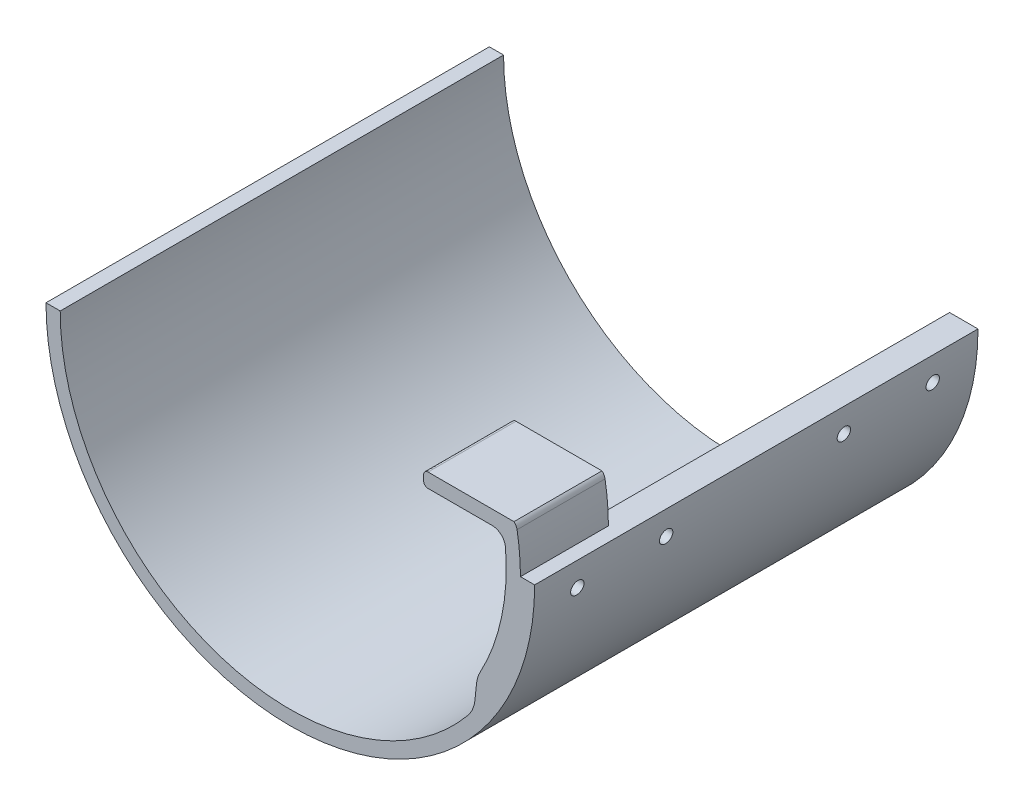
from build123d import *

# Parameters (mm, degrees)
EXTRUDE_1_DEPTH     = 99.8
SKETCH_7_R          = 1.5
CUT_EXTRUDE_6_DEPTH = 80
CUT_EXTRUDE_7_DEPTH = 80


with BuildPart() as part:
    # 草图1 → 凸台-拉伸1 (new body)
    with BuildSketch(Plane.XY):
        with BuildLine():
            Line((-55, 0), (-51.8, 0))
            ThreePointArc((-51.8, 0), (-17.476086779, -48.76296126), (40.00796876, -32.902924425))
            ThreePointArc((40.00796876, -32.902924425), (41.062164054, -31.150956215), (41.565129022, -29.16910189))
            Line((41.565129022, -29.16910189), (41.910264928, -25.795992674))
            ThreePointArc((41.910264928, -25.795992674), (42.185460224, -24.44340265), (42.720717667, -23.171108779))
            ThreePointArc((42.720717667, -23.171108779), (47.564735827, -9.977770578), (48.43095601, 4.05))
            ThreePointArc((48.43095601, 4.05), (47.472400425, 6.007940217), (45.441390824, 6.8))
            Line((45.441390824, 6.8), (31, 6.8))
            ThreePointArc((31, 6.8), (30.292893219, 7.092893219), (30, 7.8))
            Line((30, 7.8), (30, 9))
            ThreePointArc((30, 9), (30.292893219, 9.707106781), (31, 10))
            Line((31, 10), (50.344019583, 10))
            ThreePointArc((50.344019583, 10), (50.805346897, 9.459374484), (51.0484918, 8.791557597))
            ThreePointArc((51.0484918, 8.791557597), (51.611780996, 4.411809423), (51.8, 0))
            Line((51.8, 0), (55, 0))
            ThreePointArc((55, 0), (0, -55), (-55, 0))
        make_face()
    extrude(amount=EXTRUDE_1_DEPTH)

    # 草图7 → 切除-拉伸6 (cut)
    with BuildSketch(Plane(origin=(0, 0, 0), x_dir=(0.10066073352284005, 0.994920809274107, 0), z_dir=(-0.9949208092741069, 0.10066073352284004, 0))):
        with Locations(Location((-0.136340344, -9.9, 0), (0, 0, 180))):
            Circle(SKETCH_7_R)
        with Locations(Location((-0.136340344, -29.9, 0), (0, 0, 180))):
            Circle(SKETCH_7_R)
        with Locations(Location((-0.136340344, -69.9, 0), (0, 0, 180))):
            Circle(SKETCH_7_R)
        with Locations(Location((-0.136340344, -89.9, 0), (0, 0, 180))):
            Circle(SKETCH_7_R)
    extrude(amount=-CUT_EXTRUDE_6_DEPTH, mode=Mode.SUBTRACT)

    # 草图8 → 切除-拉伸7 (cut)
    with BuildSketch(Plane(origin=(0, 0, 0), x_dir=(-1, 0, 0), z_dir=(0, 0, -1))):
        with BuildLine():
            Line((-50.016978469, 22.875792113), (0, 0))
            Line((0, 0), (-55, 0))
            ThreePointArc((-55, 0), (-53.739807479, 11.70611345), (-50.016978469, 22.875792113))
        make_face()
    extrude(amount=-CUT_EXTRUDE_7_DEPTH, mode=Mode.SUBTRACT)


solid = part.part
